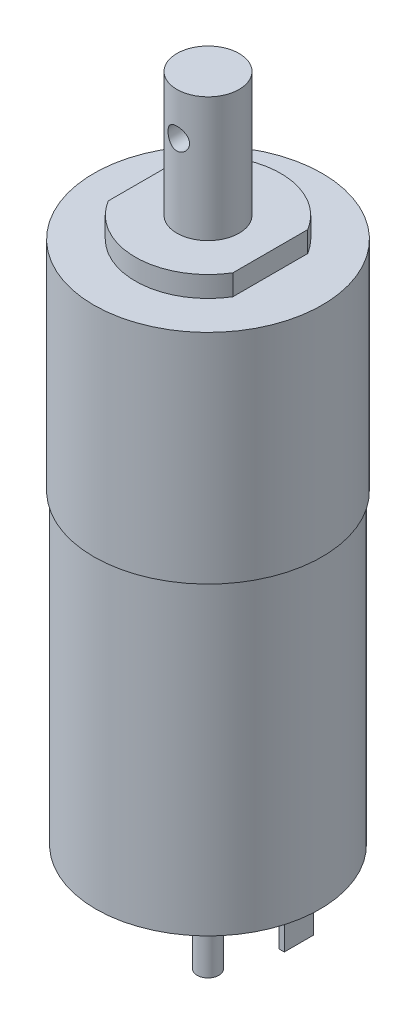
from build123d import *

# Parameters (mm, degrees)
SKETCH2_R           = 10.8
BOSS_EXTRUDE1_DEPTH = 29.5
SKETCH3_R           = 11
BOSS_EXTRUDE2_DEPTH = 21
BOSS_EXTRUDE3_DEPTH = 2
SKETCH5_R           = 3
BOSS_EXTRUDE4_DEPTH = 12
SKETCH6_R           = 3.75
BOSS_EXTRUDE5_DEPTH = 2
SKETCH7_W           = 0.5
SKETCH7_H           = 2.8
BOSS_EXTRUDE6_DEPTH = 3.9
SKETCH8_R           = 1.05
BOSS_EXTRUDE7_DEPTH = 8.4
SKETCH_1_R          = 1.0375
CUT_EXTRUDE_1_DEPTH = 5


with BuildPart() as part:
    # Sketch2 → Boss-Extrude1 (new body)
    with BuildSketch(Plane(origin=(0, 0, 0), x_dir=(1, 0, 0), z_dir=(0, 1, 0))):
        with Locations(Location((0, 0, 0), (0, 0, 270))):
            Circle(SKETCH2_R)
    extrude(amount=BOSS_EXTRUDE1_DEPTH)

    # Sketch3 → Boss-Extrude2 (add)
    with BuildSketch(Plane(origin=(0, 29.5, 0), x_dir=(1, 0, 0), z_dir=(0, 1, 0))):
        with Locations(Location((0, 0, 0), (0, 0, 90))):
            Circle(SKETCH3_R)
    extrude(amount=BOSS_EXTRUDE2_DEPTH)

    # Sketch4 → Boss-Extrude3 (add)
    with BuildSketch(Plane(origin=(0, 50.5, 0), x_dir=(1, 0, 0), z_dir=(0, 1, 0))):
        with BuildLine():
            Line((6, 3.605551275), (6, -3.605551275))
            ThreePointArc((6, -3.605551275), (0, -7), (-6, -3.605551275))
            Line((-6, -3.605551275), (-6, 3.605551275))
            ThreePointArc((-6, 3.605551275), (0, 7), (6, 3.605551275))
        make_face()
    extrude(amount=BOSS_EXTRUDE3_DEPTH)

    # Sketch5 → Boss-Extrude4 (add)
    with BuildSketch(Plane(origin=(0, 52.5, 0), x_dir=(1, 0, 0), z_dir=(0, 1, 0))):
        with Locations(Location((0, 0, 0), (0, 0, 270))):
            Circle(SKETCH5_R)
    extrude(amount=BOSS_EXTRUDE4_DEPTH)

    # Sketch6 → Boss-Extrude5 (add)
    with BuildSketch(Plane.XZ):
        with Locations(Location((0, 0, 0), (0, 0, 270))):
            Circle(SKETCH6_R)
    extrude(amount=BOSS_EXTRUDE5_DEPTH)

    # Sketch7 → Boss-Extrude6 (add)
    with BuildSketch(Plane.XZ):
        with Locations((-8.5, 0)):
            Rectangle(SKETCH7_W, SKETCH7_H)
        with Locations((8.5, 0)):
            Rectangle(SKETCH7_W, SKETCH7_H)
    extrude(amount=BOSS_EXTRUDE6_DEPTH)

    # Sketch8 → Boss-Extrude7 (add)
    with BuildSketch(Plane.XZ.offset(2)):
        with Locations(Location((0, 0, 0), (0, 0, 270))):
            Circle(SKETCH8_R)
    extrude(amount=BOSS_EXTRUDE7_DEPTH)

    # 草图1 → 切除-拉伸1 (cut, symmetric)
    with BuildSketch(Plane.XY):
        with Locations(Location((0, 60.4, 0), (0, 0, 89.999999986))):
            Circle(SKETCH_1_R)
    extrude(amount=CUT_EXTRUDE_1_DEPTH, both=True, mode=Mode.SUBTRACT)


solid = part.part
